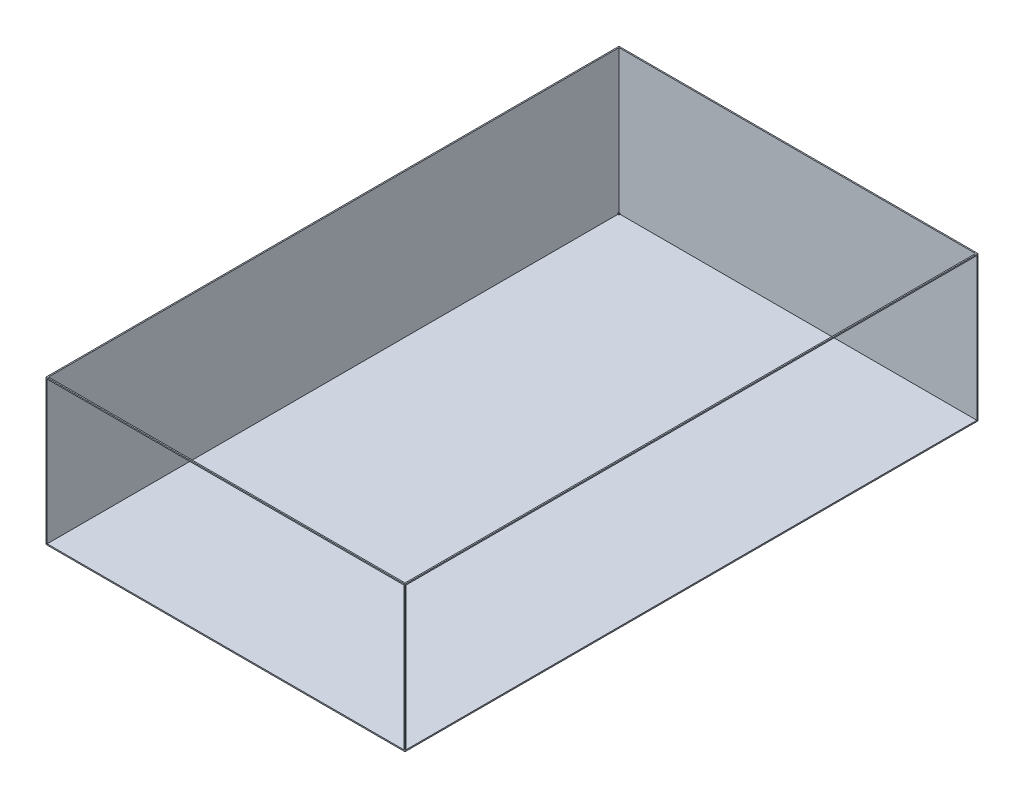
from build123d import *

# Parameters (mm, degrees)
SKETCH2_W           = 75.5
SKETCH2_H           = 30.5
BOSS_EXTRUDE2_DEPTH = 120.5
SKETCH4_W           = 75
SKETCH4_H           = 30
CUT_EXTRUDE1_DEPTH  = 120
SKETCH5_W           = 75
SKETCH5_H           = 120
CUT_EXTRUDE2_DEPTH  = 30
SKETCH6_W           = 120
SKETCH6_H           = 30
CUT_EXTRUDE3_DEPTH  = 75


with BuildPart() as part:
    # Sketch2 → Boss-Extrude2 (new body)
    with BuildSketch(Plane.XY):
        with Locations((37.75, 15.25)):
            Rectangle(SKETCH2_W, SKETCH2_H)
    extrude(amount=-BOSS_EXTRUDE2_DEPTH)

    # Sketch4 → Cut-Extrude1 (cut)
    with BuildSketch(Plane.XY):
        with Locations((37.75, 15.25)):
            Rectangle(SKETCH4_W, SKETCH4_H)
    extrude(amount=-CUT_EXTRUDE1_DEPTH, mode=Mode.SUBTRACT)

    # Sketch5 → Cut-Extrude2 (cut)
    with BuildSketch(Plane(origin=(0, 30.5, 0), x_dir=(1, 0, 0), z_dir=(0, 1, 0))):
        with Locations((37.75, 60.25)):
            Rectangle(SKETCH5_W, SKETCH5_H)
    extrude(amount=-CUT_EXTRUDE2_DEPTH, mode=Mode.SUBTRACT)

    # Sketch6 → Cut-Extrude3 (cut)
    with BuildSketch(Plane(origin=(75.5, 0, 0), x_dir=(0, 0, -1), z_dir=(1, 0, 0))):
        with Locations((60.25, 15.25)):
            Rectangle(SKETCH6_W, SKETCH6_H)
    extrude(amount=-CUT_EXTRUDE3_DEPTH, mode=Mode.SUBTRACT)


solid = part.part
